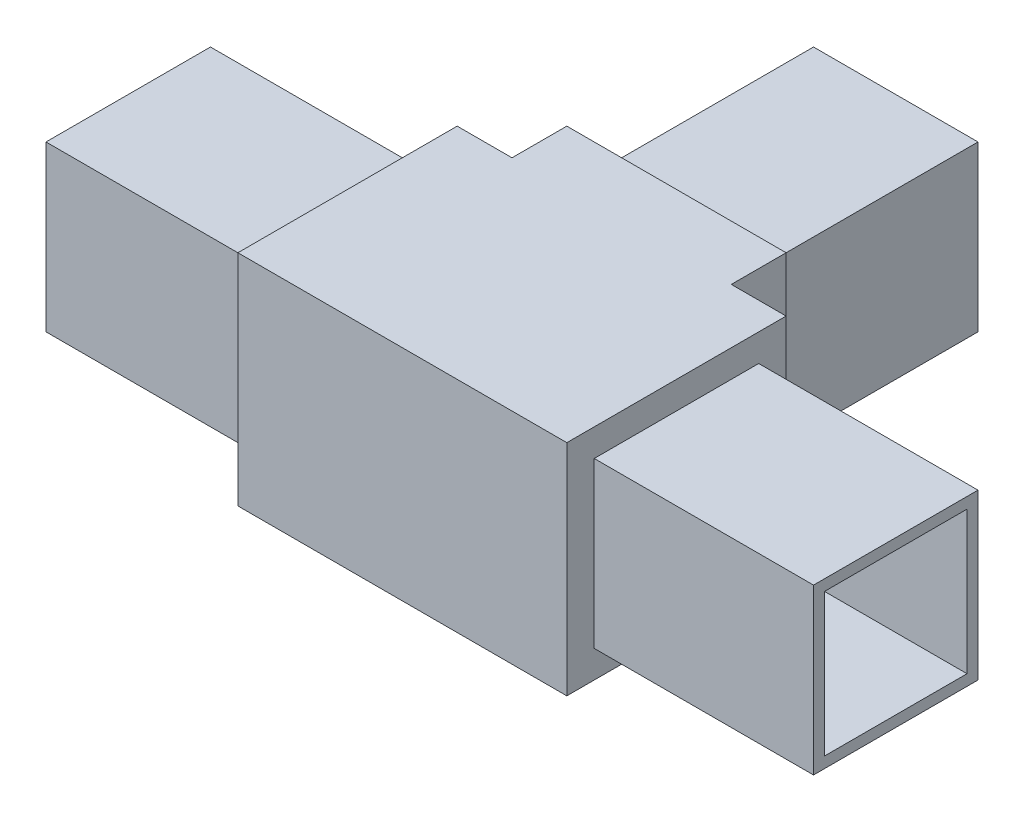
from build123d import *

# Parameters (mm, degrees)
CROQUIS1_W     = 40
CROQUIS1_H     = 50
CROQUIS1_H_2   = 40
CROQUIS1_W_2   = 50
EXTRUIR1_DEPTH = 40
CROQUIS2_W     = 40
CROQUIS2_H     = 40
CROQUIS2_W_2   = 30
CROQUIS2_H_2   = 30
EXTRUIR2_DEPTH = 40
CROQUIS3_W     = 40
CROQUIS3_H     = 40
CROQUIS3_W_2   = 30
CROQUIS3_H_2   = 30
EXTRUIR3_DEPTH = 40
CROQUIS5_W     = 40
CROQUIS5_H     = 40
CROQUIS5_W_2   = 30
CROQUIS5_H_2   = 30
EXTRUIR4_DEPTH = 40
VACIADO1_T     = -2


with BuildPart() as part:
    # Croquis1 → Extruir1 (new body)
    with BuildSketch(Plane(origin=(0, 0, 0), x_dir=(1, 0, 0), z_dir=(0, 1, 0))):
        with Locations((0, 45)):
            Rectangle(CROQUIS1_W, CROQUIS1_H)
        Rectangle(CROQUIS1_W, CROQUIS1_H_2)
        with Locations((45, 0)):
            Rectangle(CROQUIS1_W_2, CROQUIS1_H_2)
        with Locations((-45, 0)):
            Rectangle(CROQUIS1_W_2, CROQUIS1_H_2)
    extrude(amount=EXTRUIR1_DEPTH)

    # Croquis2 → Extruir2 (cut)
    with BuildSketch(Plane(origin=(70, 0, 0), x_dir=(0, 0, -1), z_dir=(1, 0, 0))):
        with Locations((0, 20)):
            Rectangle(CROQUIS2_W, CROQUIS2_H)
        with Locations((0, 20)):
            Rectangle(CROQUIS2_W_2, CROQUIS2_H_2, mode=Mode.SUBTRACT)
    extrude(amount=-EXTRUIR2_DEPTH, mode=Mode.SUBTRACT)

    # Croquis3 → Extruir3 (cut)
    with BuildSketch(Plane(origin=(0, 0, -70), x_dir=(-1, 0, 0), z_dir=(0, 0, -1))):
        with Locations((0, 20)):
            Rectangle(CROQUIS3_W, CROQUIS3_H)
        with Locations((0, 20)):
            Rectangle(CROQUIS3_W_2, CROQUIS3_H_2, mode=Mode.SUBTRACT)
    extrude(amount=-EXTRUIR3_DEPTH, mode=Mode.SUBTRACT)

    # Croquis5 → Extruir4 (cut)
    with BuildSketch(Plane.ZY.offset(70)):
        with Locations((0, 20)):
            Rectangle(CROQUIS5_W, CROQUIS5_H)
        with Locations((0, 20)):
            Rectangle(CROQUIS5_W_2, CROQUIS5_H_2, mode=Mode.SUBTRACT)
    extrude(amount=-EXTRUIR4_DEPTH, mode=Mode.SUBTRACT)

    # Vaciado1
    vaciado1_openings = [part.faces().sort_by_distance(p)[0] for p in [
        (70, 20, 0),
        (0, 20, -70),
        (-70, 20, 0),
    ]]
    offset(amount=VACIADO1_T, openings=vaciado1_openings, kind=Kind.INTERSECTION)


solid = part.part
